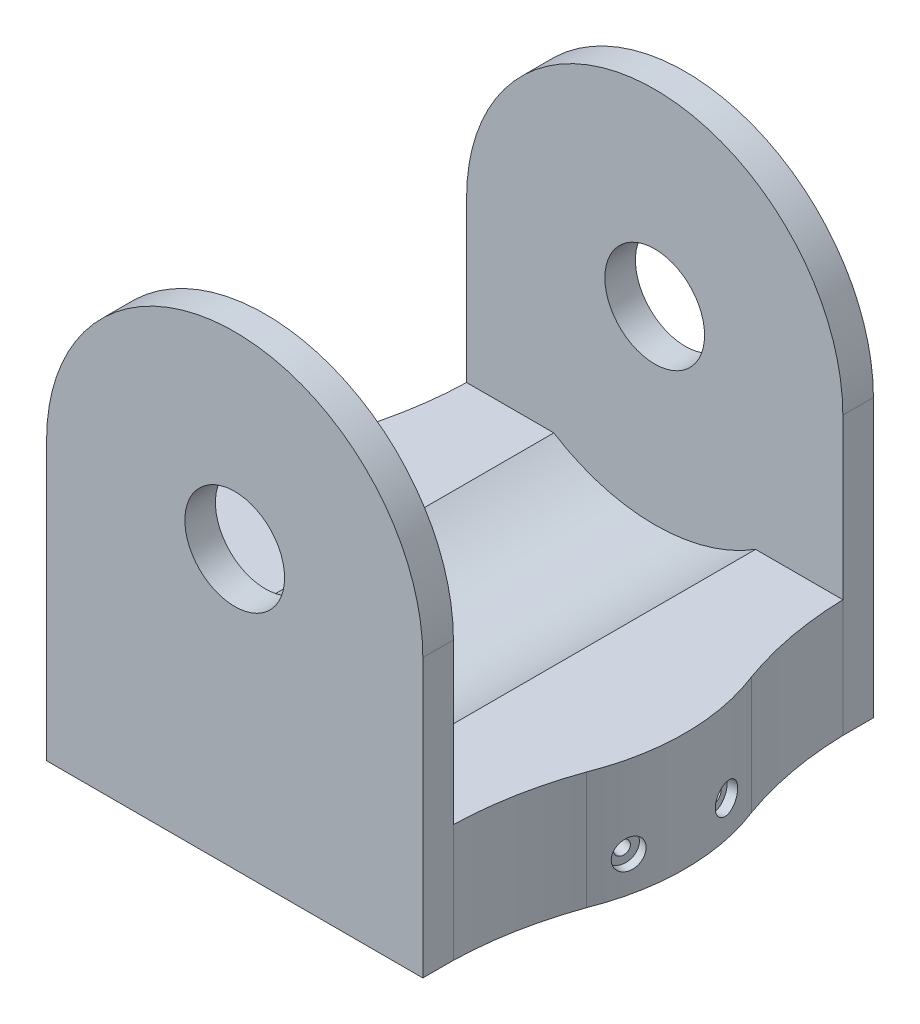
from build123d import *

# Parameters (mm, degrees)
SKETCH1_R                  = 47.8
SKETCH1_R_2                = 41.5
CAP_BASE_DEPTH             = 15
SKETCH2_R                  = 47.8
CAP_TOP_DEPTH              = 10
SIDES_START                = 41.4
SIDES_DEPTH                = 6.5
SIDES_START_2              = -25
SIDES_TO_CAP_DEPTH         = 25
SKETCH5_R                  = 40.2
TRACKS_FOR_HOUSING_DEPTH   = 45
SKETCH6_R                  = 10.6
HOLE_FOR_GEAR_SHAFTS_DEPTH = 146.82002606
SKETCH9_R                  = 1.5
CUT_EXTRUDE2_DEPTH         = 10
CIRPATTERN1_COUNT          = 2
CIRPATTERN1_ANGLE          = 25
MIRROR2_COPY_1_SKETCH_R    = 1.5
MIRROR2_COPY_1_DEPTH       = 10
SKETCH10_R                 = 3.1
CUT_EXTRUDE3_DEPTH         = 2
CIRPATTERN2_COUNT          = 2
CIRPATTERN2_ANGLE          = 25
MIRROR3_COPY_1_SKETCH_R    = 3.1
MIRROR3_COPY_1_DEPTH       = 2


with BuildPart() as part:
    # Sketch1 → Cap base (new body)
    with BuildSketch(Plane(origin=(0, 0, 0), x_dir=(1, 0, 0), z_dir=(0, 1, 0))):
        with Locations(Location((0, 0, 0), (0, 0, 270))):
            Circle(SKETCH1_R)
        with Locations(Location((0, 0, 0), (0, 0, 270))):
            Circle(SKETCH1_R_2, mode=Mode.SUBTRACT)
    extrude(amount=CAP_BASE_DEPTH)

    # Sketch2 → Cap top (add)
    with BuildSketch(Plane(origin=(0, 15, 0), x_dir=(1, 0, 0), z_dir=(0, 1, 0))):
        with Locations(Location((0, 0, 0), (0, 0, 270))):
            Circle(SKETCH2_R)
    extrude(amount=CAP_TOP_DEPTH)

    # Sketch3 → Sides (add)
    with BuildSketch(Plane.XY.offset(SIDES_START)):
        with BuildLine():
            Line((-40, 59), (-40, 0))
            Line((-40, 0), (40, 0))
            Line((40, 0), (40, 59))
            ThreePointArc((40, 59), (0, 99), (-40, 59))
        make_face()
    sides = extrude(amount=SIDES_DEPTH)

    # Sketch4 → Sides to cap (add)
    with BuildSketch(Plane(origin=(0, 25, 0), x_dir=(1, 0, 0), z_dir=(0, 1, 0)).offset(SIDES_START_2)):
        with BuildLine():
            ThreePointArc((-23.893095237, -41.4), (-36.205132569, -31.209427673), (-44.469611721, -17.529792737))
            ThreePointArc((-44.469611721, -17.529792737), (-41.281194911, -29.286336098), (-40, -41.4))
            Line((-40, -41.4), (-23.893095237, -41.4))
        make_face()
        with BuildLine():
            Line((23.893095237, -41.4), (40, -41.4))
            ThreePointArc((40, -41.4), (41.281194911, -29.286336098), (44.469611721, -17.529792737))
            ThreePointArc((44.469611721, -17.529792737), (36.205132569, -31.209427673), (23.893095237, -41.4))
        make_face()
    sides_to_cap = extrude(amount=SIDES_TO_CAP_DEPTH)

    # Mirror1: Sides to cap across plane
    add(sides_to_cap.mirror(Plane.XY))

    # Mirror sides: Sides across plane
    add(sides.mirror(Plane.XY))

    # Sketch5 → Tracks for housing (cut)
    with BuildSketch(Plane(origin=(0, 0, 41.4), x_dir=(-1, 0, 0), z_dir=(0, 0, -1))):
        with Locations((0, 59)):
            Circle(SKETCH5_R)
    tracks_for_housing = extrude(amount=TRACKS_FOR_HOUSING_DEPTH, mode=Mode.SUBTRACT)

    # Mirror tracks: Tracks for housing across plane
    add(tracks_for_housing.mirror(Plane.XY), mode=Mode.SUBTRACT)

    # Sketch6 → Hole for gear shafts (cut, through all)
    with BuildSketch(Plane.XY.offset(47.9)):
        with Locations((0, 59)):
            Circle(SKETCH6_R)
    extrude(amount=-HOLE_FOR_GEAR_SHAFTS_DEPTH, mode=Mode.SUBTRACT)

    # Sketch9 → Cut-Extrude2 (cut)
    with BuildSketch(Plane(origin=(46.73476934, 0, -10.035005469), x_dir=(-0.20993735290442256, 0, -0.9777148397439225), z_dir=(0.9777148397439225, 0, -0.20993735290442256))):
        with Locations((0, 7.5)):
            Circle(SKETCH9_R)
    cut_extrude2 = extrude(amount=-CUT_EXTRUDE2_DEPTH, mode=Mode.SUBTRACT)

    # CirPattern1: Cut-Extrude2 ×2 about axis
    cirpattern1_axis = Axis((0, 15, 0), (0, -1, 0))
    for i in range(1, CIRPATTERN1_COUNT):
        add(cut_extrude2.rotate(cirpattern1_axis, i * CIRPATTERN1_ANGLE / (CIRPATTERN1_COUNT - 1)), mode=Mode.SUBTRACT)

    # Mirror2: Cut-Extrude2 across plane
    add(cut_extrude2.mirror(Plane(origin=(0, 0, 0), x_dir=(0, 0, 1), z_dir=(1, 0, 0))), mode=Mode.SUBTRACT)

    # Mirror2 copy 1 sketch → Mirror2 copy 1 (cut)
    with BuildSketch(Plane(origin=(-46.597061946, 0, 10.656163382), x_dir=(-0.2229322883235245, 0, -0.9748339319201179), z_dir=(-0.9748339319201179, 0, 0.2229322883235245))):
        with Locations((0, -7.5)):
            Circle(MIRROR2_COPY_1_SKETCH_R)
    extrude(amount=-MIRROR2_COPY_1_DEPTH, mode=Mode.SUBTRACT)

    # Sketch10 → Cut-Extrude3 (cut)
    with BuildSketch(Plane(origin=(46.73476934, 0, -10.035005469), x_dir=(-0.20993735290442256, 0, -0.9777148397439225), z_dir=(0.9777148397439225, 0, -0.20993735290442256))):
        with Locations((0, 7.5)):
            Circle(SKETCH10_R)
    cut_extrude3 = extrude(amount=-CUT_EXTRUDE3_DEPTH, mode=Mode.SUBTRACT)

    # CirPattern2: Cut-Extrude3 ×2 about axis
    cirpattern2_axis = Axis((0, 15, 0), (0, -1, 0))
    for i in range(1, CIRPATTERN2_COUNT):
        add(cut_extrude3.rotate(cirpattern2_axis, i * CIRPATTERN2_ANGLE / (CIRPATTERN2_COUNT - 1)), mode=Mode.SUBTRACT)

    # Mirror3: Cut-Extrude3 across plane
    add(cut_extrude3.mirror(Plane(origin=(0, 0, 0), x_dir=(0, 0, 1), z_dir=(1, 0, 0))), mode=Mode.SUBTRACT)

    # Mirror3 copy 1 sketch → Mirror3 copy 1 (cut)
    with BuildSketch(Plane(origin=(-46.597061946, 0, 10.656163382), x_dir=(-0.22293228832352457, 0, -0.9748339319201178), z_dir=(-0.9748339319201178, 0, 0.22293228832352457))):
        with Locations((0, -7.5)):
            Circle(MIRROR3_COPY_1_SKETCH_R)
    extrude(amount=-MIRROR3_COPY_1_DEPTH, mode=Mode.SUBTRACT)


solid = part.part
